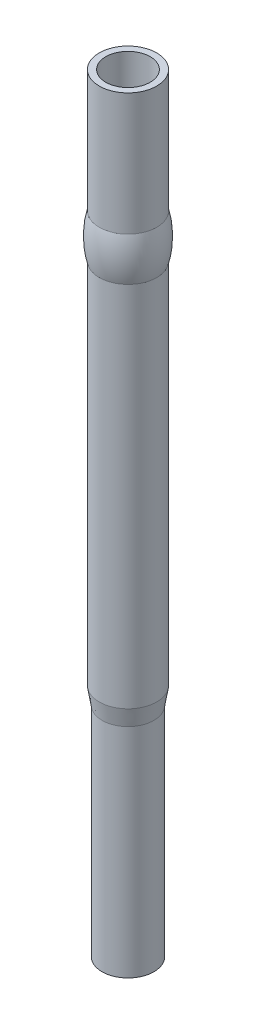
from build123d import *


with BuildPart() as part:
    # Sketch1 → Revolve1 (revolve)
    with BuildSketch(Plane(origin=(0, 0, 0), x_dir=(0, 0, -1), z_dir=(1, 0, 0)), mode=Mode.PRIVATE) as revolve1_sk:
        with BuildLine():
            Line((0.51, 0), (0.51, -9.9))
            Line((0.51, -9.9), (0, -9.9))
            Line((0, -9.9), (0, -12.65))
            Line((0, -12.65), (0.455, -12.65))
            Line((0.455, -12.65), (0.455, -17.65))
            Line((0.455, -17.65), (0.595, -17.65))
            Line((0.595, -17.65), (0.595, -12.65))
            Line((0.595, -12.65), (0.66, -12.25))
            Line((0.66, -12.25), (0.66, -3.81))
            ThreePointArc((0.66, -3.81), (0.725, -3.31), (0.66, -2.81))
            Line((0.66, -2.81), (0.66, 0))
            Line((0.66, 0), (0.51, 0))
        make_face()
    revolve(revolve1_sk.sketch.rotate(Axis((0, -9.9, 0), (0, -1, 0)), 180), axis=Axis((0, -9.9, 0), (0, -1, 0)))


solid = part.part
